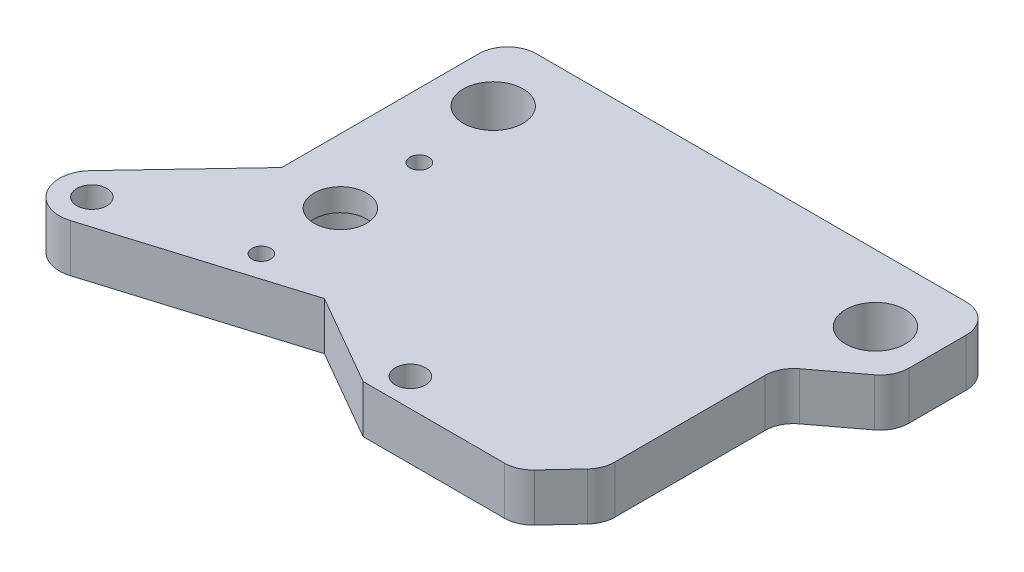
from build123d import *

# Parameters (mm, degrees)
SKETCH4_R           = 2
SKETCH4_R_2         = 1.25
SKETCH4_R_3         = 5
SKETCH4_R_4         = 3.96875
BOSS_EXTRUDE2_DEPTH = 6.35
SKETCH33_R          = 5
SKETCH33_R_2        = 3.499999985
BOSS_EXTRUDE6_DEPTH = 3


with BuildPart() as part:
    # Sketch4 → Boss-Extrude2 (new body)
    # profile 1 of 2: a face of its own
    with BuildSketch(Plane(origin=(0, 0, 0), x_dir=(1, 0, 0), z_dir=(0, 1, 0))):
        with BuildLine():
            Line((21.46596982, -18.4375), (40.257702493, -18.4375))
            ThreePointArc((40.257702493, -18.4375), (41.776936446, -18.121498883), (43.044160097, -17.225913752))
            Line((43.044160097, -17.225913752), (46.444939319, -13.579024524))
            ThreePointArc((46.444939319, -13.579024524), (47.203372649, -12.376980446), (47.468481715, -10.980610773))
            Line((47.468481715, -10.980610773), (47.468481715, 8.985116992))
            ThreePointArc((47.468481715, 8.985116992), (47.868781798, 10.685130659), (48.985566477, 12.027918285))
            Line((48.985566477, 12.027918285), (54.680415238, 16.319294633))
            ThreePointArc((54.680415238, 16.319294633), (55.797199918, 17.662082259), (56.1975, 19.362095927))
            Line((56.1975, 19.362095927), (56.1975, 26.9875))
            ThreePointArc((56.1975, 26.9875), (55.081576836, 29.681576836), (52.3875, 30.7975))
            Line((52.3875, 30.7975), (-4.7625, 30.7975))
            ThreePointArc((-4.7625, 30.7975), (-7.456576836, 29.681576836), (-8.5725, 26.9875))
            Line((-8.5725, 26.9875), (-8.5725, 0.781747009))
            Line((-8.5725, 0.781747009), (-20.917416467, -12.27322702))
            ThreePointArc((-20.917416467, -12.27322702), (-21.4498857, -17.515316011), (-16.517810325, -19.369406885))
            Line((-16.517810325, -19.369406885), (9.346561417, -11.463733294))
            Line((9.346561417, -11.463733294), (21.46596982, -18.4375))
        make_face()
        with Locations(Location((-17.78, -15.24, 0), (0, 0, 270))):
            Circle(SKETCH4_R, mode=Mode.SUBTRACT)
        with Locations(Location((0, -10.5, 0), (0, 0, 270))):
            Circle(SKETCH4_R_2, mode=Mode.SUBTRACT)
        with Locations(Location((0, 0, 0), (0, 0, 270))):
            Circle(SKETCH4_R_3, mode=Mode.SUBTRACT)
        with Locations(Location((24.012521227, -14.703599027, 0), (0, 0, 270))):
            Circle(SKETCH4_R, mode=Mode.SUBTRACT)
        with Locations(Location((0, 10.5, 0), (0, 0, 270))):
            Circle(SKETCH4_R_2, mode=Mode.SUBTRACT)
        with Locations(Location((-1.5875, 21.9075, 0), (0, 0, 270))):
            Circle(SKETCH4_R_4, mode=Mode.SUBTRACT)
        with Locations(Location((49.2125, 21.9075, 0), (0, 0, 270))):
            Circle(SKETCH4_R_4, mode=Mode.SUBTRACT)
    # profile 2 of 2: a face of its own
    with BuildSketch(Plane(origin=(0, 0, 0), x_dir=(1, 0, 0), z_dir=(0, 1, 0))):
        with BuildLine():
            Line((21.46596982, -18.4375), (40.257702493, -18.4375))
            ThreePointArc((40.257702493, -18.4375), (41.776936446, -18.121498883), (43.044160097, -17.225913752))
            Line((43.044160097, -17.225913752), (46.444939319, -13.579024524))
            ThreePointArc((46.444939319, -13.579024524), (47.203372649, -12.376980446), (47.468481715, -10.980610773))
            Line((47.468481715, -10.980610773), (47.468481715, 8.985116992))
            ThreePointArc((47.468481715, 8.985116992), (47.868781798, 10.685130659), (48.985566477, 12.027918285))
            Line((48.985566477, 12.027918285), (54.680415238, 16.319294633))
            ThreePointArc((54.680415238, 16.319294633), (55.797199918, 17.662082259), (56.1975, 19.362095927))
            Line((56.1975, 19.362095927), (56.1975, 26.9875))
            ThreePointArc((56.1975, 26.9875), (55.081576836, 29.681576836), (52.3875, 30.7975))
            Line((52.3875, 30.7975), (-4.7625, 30.7975))
            ThreePointArc((-4.7625, 30.7975), (-7.456576836, 29.681576836), (-8.5725, 26.9875))
            Line((-8.5725, 26.9875), (-8.5725, 0.781747009))
            Line((-8.5725, 0.781747009), (-20.917416467, -12.27322702))
            ThreePointArc((-20.917416467, -12.27322702), (-21.4498857, -17.515316011), (-16.517810325, -19.369406885))
            Line((-16.517810325, -19.369406885), (9.346561417, -11.463733294))
            Line((9.346561417, -11.463733294), (21.46596982, -18.4375))
        make_face()
        with Locations(Location((-17.78, -15.24, 0), (0, 0, 270))):
            Circle(SKETCH4_R, mode=Mode.SUBTRACT)
        with Locations(Location((0, -10.5, 0), (0, 0, 270))):
            Circle(SKETCH4_R_2, mode=Mode.SUBTRACT)
        with Locations(Location((0, 0, 0), (0, 0, 270))):
            Circle(SKETCH4_R_3, mode=Mode.SUBTRACT)
        with Locations(Location((24.012521227, -14.703599027, 0), (0, 0, 270))):
            Circle(SKETCH4_R, mode=Mode.SUBTRACT)
        with Locations(Location((0, 10.5, 0), (0, 0, 270))):
            Circle(SKETCH4_R_2, mode=Mode.SUBTRACT)
        with Locations(Location((-1.5875, 21.9075, 0), (0, 0, 270))):
            Circle(SKETCH4_R_4, mode=Mode.SUBTRACT)
        with Locations(Location((49.2125, 21.9075, 0), (0, 0, 270))):
            Circle(SKETCH4_R_4, mode=Mode.SUBTRACT)
    extrude(amount=-BOSS_EXTRUDE2_DEPTH)

    # Sketch33 → Boss-Extrude6 (add)
    with BuildSketch(Plane(origin=(0, 0, 0), x_dir=(1, 0, 0), z_dir=(0, 1, 0))):
        with Locations(Location((0, 0, 0), (0, 0, 270))):
            Circle(SKETCH33_R)
        with Locations(Location((0, 0, 0), (0, 0, 270))):
            Circle(SKETCH33_R_2, mode=Mode.SUBTRACT)
    extrude(amount=-BOSS_EXTRUDE6_DEPTH)


solid = part.part
